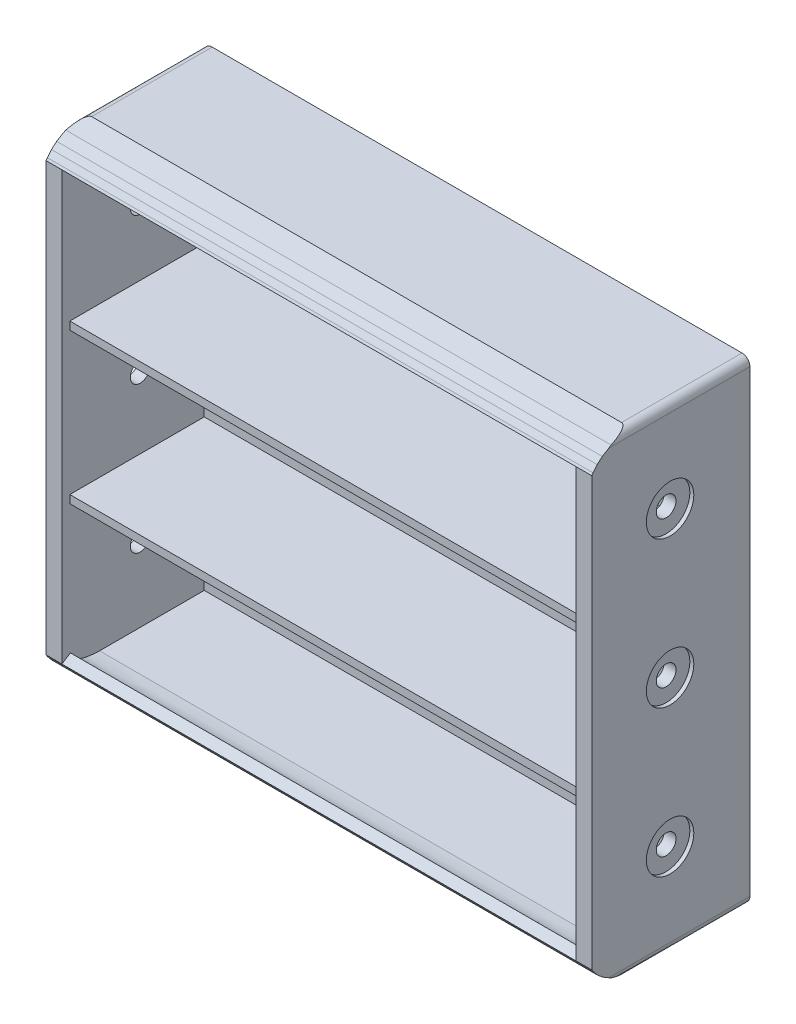
from build123d import *

# Parameters (mm, degrees)
SKETCH2_W           = 69
SKETCH2_H           = 60
SKETCH2_W_2         = 65
SKETCH2_H_2         = 56
BOSS_EXTRUDE1_DEPTH = 19
SKETCH3_W           = 69
SKETCH3_H           = 60
BOSS_EXTRUDE2_DEPTH = 1
BOSS_EXTRUDE4_DEPTH = 67.5
CUT_EXTRUDE1_DEPTH  = 135
SKETCH7_W           = 84.404027411
SKETCH7_H           = 26.874448114
CUT_EXTRUDE2_DEPTH  = 135
SKETCH9_W           = 65
SKETCH9_H           = 1
BOSS_EXTRUDE5_DEPTH = 17
FILLET1_R           = 1
SKETCH10_R          = 3
CUT_EXTRUDE6_DEPTH  = 0.5
CUT_EXTRUDE7_REACH  = 79.602
SKETCH11_R          = 1.25


with BuildPart() as part:
    # Sketch2 → Boss-Extrude1 (new body)
    with BuildSketch(Plane.XY):
        Rectangle(SKETCH2_W, SKETCH2_H)
        Rectangle(SKETCH2_W_2, SKETCH2_H_2, mode=Mode.SUBTRACT)
    extrude(amount=BOSS_EXTRUDE1_DEPTH)

    # Sketch3 → Boss-Extrude2 (add, symmetric)
    with BuildSketch(Plane(origin=(0, 0, 0), x_dir=(-1, 0, 0), z_dir=(0, 0, -1))):
        Rectangle(SKETCH3_W, SKETCH3_H)
    extrude(amount=BOSS_EXTRUDE2_DEPTH, both=True)

    # Sketch4 → Boss-Extrude4 (add, symmetric)
    with BuildSketch(Plane.ZY.offset(34.5)):
        with BuildLine():
            Line((19, -27.062112177), (17.917720438, -26.385779399))
            add(Edge.make_bspline(
                [(17.917720438, -26.385779399), (17.068052287, -28.229247979), (14.940376438, -27.841186756), (13.351451557, -28.086320914)],
                knots=[0, 0, 0, 0, 1, 1, 1, 1], degree=3))
            Line((13.351451557, -28.086320914), (14.231772034, -30))
            add(Edge.make_bspline(
                [(14.231772034, -30), (17.788479479, -29.104156819), (19, -27.062112177)],
                knots=[0, 0, 0, 0.719469437, 0.719469437, 0.719469437], degree=2))
        make_face()
        with BuildLine():
            Line((14.231772034, 30), (13.351451557, 28.086320914))
            add(Edge.make_bspline(
                [(17.917720438, 26.385779399), (17.068052287, 28.229247979), (14.940376438, 27.841186756), (13.351451557, 28.086320914)],
                knots=[0, 0, 0, 0, 1, 1, 1, 1], degree=3))
            Line((17.917720438, 26.385779399), (19, 27.062112177))
            add(Edge.make_bspline(
                [(14.231772034, 30), (17.788479479, 29.104156819), (19, 27.062112177)],
                knots=[0, 0, 0, 0.719469437, 0.719469437, 0.719469437], degree=2))
        make_face()
    extrude(amount=BOSS_EXTRUDE4_DEPTH, both=True)

    # Sketch6 → Cut-Extrude1 (cut)
    with BuildSketch(Plane.ZY.offset(34.5)):
        Polygon((19, -30), (19, -27.062112177), (18.840520093, -27.311263152), (18.318412732, -27.941049653), (17.662350265, -28.50734155), (16.534506271, -29.184167719), (14.231772034, -30), align=None)
        Polygon((19, 30), (14.231772034, 30), (16.534506271, 29.184167719), (17.662350265, 28.50734155), (18.318412732, 27.941049653), (18.840520093, 27.311263152), (19, 27.062112177), align=None)
    extrude(amount=-CUT_EXTRUDE1_DEPTH, mode=Mode.SUBTRACT)

    # Sketch7 → Cut-Extrude2 (cut)
    with BuildSketch(Plane.XZ.offset(30)):
        with Locations((-76.702013706, 12.437224057)):
            Rectangle(SKETCH7_W, SKETCH7_H)
    extrude(amount=-CUT_EXTRUDE2_DEPTH, mode=Mode.SUBTRACT)

    # Sketch9 → Boss-Extrude5 (add)
    with BuildSketch(Plane.XY.offset(1)):
        with Locations((0, 9.5)):
            Rectangle(SKETCH9_W, SKETCH9_H)
        with Locations((0, -9.5)):
            Rectangle(SKETCH9_W, SKETCH9_H)
    extrude(amount=BOSS_EXTRUDE5_DEPTH)

    # Fillet1
    fillet1_edges = [part.edges().sort_by_distance(p)[0] for p in [
        (-34.5, 30, 6.615886017),
        (-34.5, -30, 6.615886017),
        (34.5, 30, 6.615886017),
        (34.5, -30, 6.615886017),
    ]]
    fillet(fillet1_edges, radius=FILLET1_R)

    # Sketch10 → Cut-Extrude6 (cut)
    with BuildSketch(Plane(origin=(34.5, 0, 0), x_dir=(0, 0, -1), z_dir=(1, 0, 0))):
        with Locations((-9.09656972, -18.5)):
            Circle(SKETCH10_R)
        with Locations((-9.09656972, 0)):
            Circle(SKETCH10_R)
        with Locations((-9.09656972, 18.5)):
            Circle(SKETCH10_R)
    cut_extrude6 = extrude(amount=-CUT_EXTRUDE6_DEPTH, mode=Mode.SUBTRACT)

    # Cut-Extrude7: up to this face of the body (flat: up to its plane)
    cut_extrude7_end = Plane(part.part.faces().sort_by_distance((-34.5, 0, 8.972249648))[0])
    # Sketch11 → Cut-Extrude7 (cut, up to the picked face)
    with BuildSketch(Plane(origin=(34.5, 0, 0), x_dir=(0, 0, -1), z_dir=(1, 0, 0)), mode=Mode.PRIVATE) as cut_extrude7_sk1:
        with Locations((-9.09656972, -18.5)):
            Circle(SKETCH11_R)
    cut_extrude7_tool1 = split(extrude(cut_extrude7_sk1.sketch, amount=-CUT_EXTRUDE7_REACH, mode=Mode.PRIVATE), bisect_by=cut_extrude7_end, keep=Keep.BOTH, mode=Mode.PRIVATE)
    # Sketch11 → Cut-Extrude7 (cut, up to the picked face)
    with BuildSketch(Plane(origin=(34.5, 0, 0), x_dir=(0, 0, -1), z_dir=(1, 0, 0)), mode=Mode.PRIVATE) as cut_extrude7_sk2:
        with Locations((-9.09656972, 0)):
            Circle(SKETCH11_R)
    cut_extrude7_tool2 = split(extrude(cut_extrude7_sk2.sketch, amount=-CUT_EXTRUDE7_REACH, mode=Mode.PRIVATE), bisect_by=cut_extrude7_end, keep=Keep.BOTH, mode=Mode.PRIVATE)
    # Sketch11 → Cut-Extrude7 (cut, up to the picked face)
    with BuildSketch(Plane(origin=(34.5, 0, 0), x_dir=(0, 0, -1), z_dir=(1, 0, 0)), mode=Mode.PRIVATE) as cut_extrude7_sk3:
        with Locations((-9.09656972, 18.5)):
            Circle(SKETCH11_R)
    cut_extrude7_tool3 = split(extrude(cut_extrude7_sk3.sketch, amount=-CUT_EXTRUDE7_REACH, mode=Mode.PRIVATE), bisect_by=cut_extrude7_end, keep=Keep.BOTH, mode=Mode.PRIVATE)
    add(cut_extrude7_tool1.solids().sort_by(Axis((34.5, -18.5, 9.09657), (-1, 0, 0)))[0], mode=Mode.SUBTRACT)
    add(cut_extrude7_tool2.solids().sort_by(Axis((34.5, 0, 9.09657), (-1, 0, 0)))[0], mode=Mode.SUBTRACT)
    add(cut_extrude7_tool3.solids().sort_by(Axis((34.5, 18.5, 9.09657), (-1, 0, 0)))[0], mode=Mode.SUBTRACT)

    # Mirror1: Cut-Extrude6 across plane
    add(cut_extrude6.mirror(Plane(origin=(0, 0, 0), x_dir=(0, 0, 1), z_dir=(1, 0, 0))), mode=Mode.SUBTRACT)


solid = part.part
